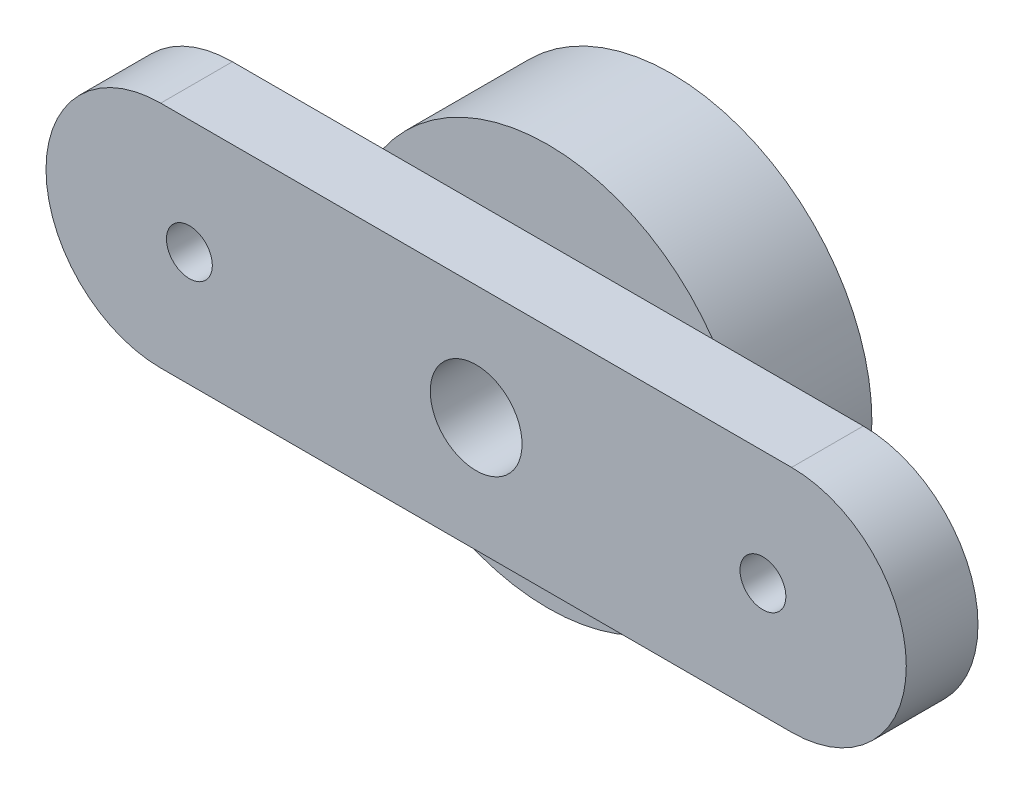
from build123d import *

# Parameters (mm, degrees)
HUB_START   = 2.2
SKETCH1_R   = 7
SKETCH1_R_2 = 3.05
HUB_DEPTH   = 4.3
ARM_START   = 6.5
SKETCH2_R   = 1.6
SKETCH2_R_2 = 0.8
ARM_DEPTH   = 2.5


with BuildPart() as part:
    # Sketch1 → Hub (new body)
    with BuildSketch(Plane.XY.offset(HUB_START)):
        with Locations(Location((0, 0, 0), (0, 0, 180))):
            Circle(SKETCH1_R)
        with Locations(Location((0, 0, 0), (0, 0, 180))):
            Circle(SKETCH1_R_2, mode=Mode.SUBTRACT)
    extrude(amount=HUB_DEPTH)

    # Sketch2 → Arm (add)
    with BuildSketch(Plane.XY.offset(ARM_START)):
        with BuildLine():
            Line((-11, 4), (11, 4))
            ThreePointArc((11, 4), (15, 0), (11, -4))
            Line((11, -4), (-11, -4))
            ThreePointArc((-11, -4), (-15, 0), (-11, 4))
        make_face()
        Circle(SKETCH2_R, mode=Mode.SUBTRACT)
        with Locations((-10, 0)):
            Circle(SKETCH2_R_2, mode=Mode.SUBTRACT)
        with Locations((10, 0)):
            Circle(SKETCH2_R_2, mode=Mode.SUBTRACT)
    extrude(amount=ARM_DEPTH)


solid = part.part
